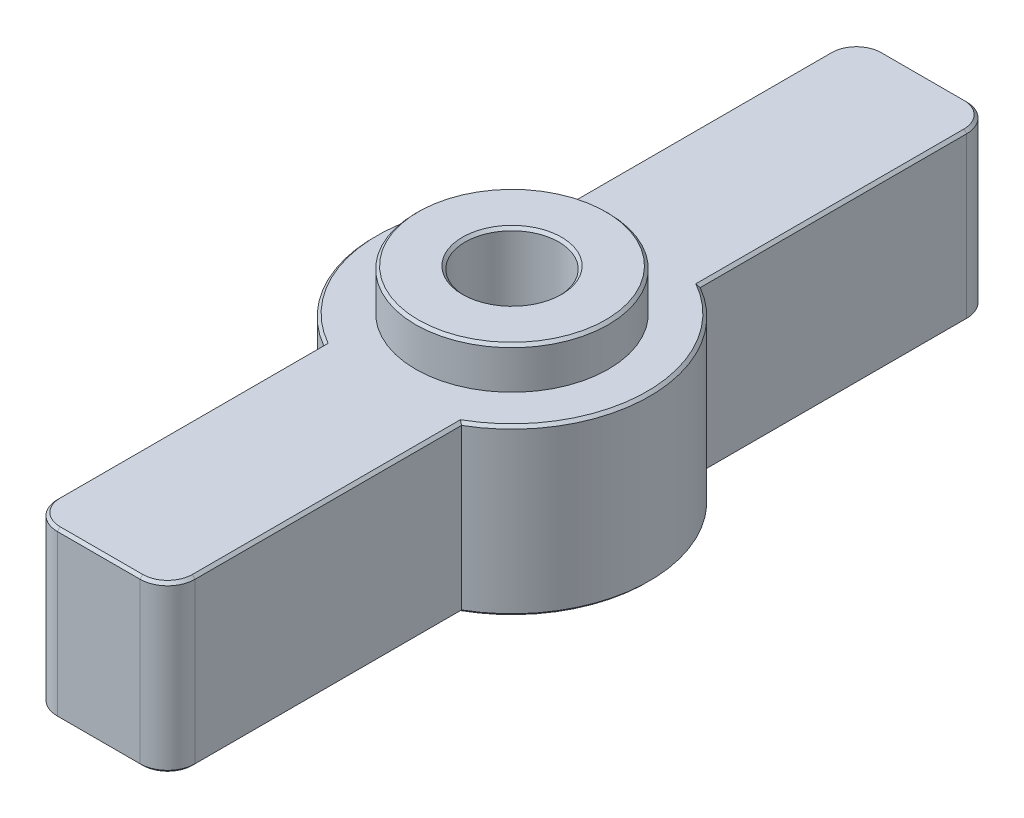
from build123d import *

# Parameters (mm, degrees)
EXTRUDE_1_DEPTH     = 12
SKETCH_2_R          = 6.75
CUT_EXTRUDE_1_DEPTH = 8.5
SKETCH_4_R          = 7
EXTRUDE_2_DEPTH     = 3
SKETCH_3_R          = 3.4
CUT_EXTRUDE_2_DEPTH = 33.74522866
CHAMFER_1_SIZE      = 0.2


with BuildPart() as part:
    # 草图1 → 凸台-拉伸1 (new body)
    with BuildSketch(Plane(origin=(0, 0, 0), x_dir=(1, 0, 0), z_dir=(0, 1, 0))):
        with BuildLine():
            Line((-5, -28), (-5, -8.660254038))
            ThreePointArc((-5, -8.660254038), (-10, 0), (-5, 8.660254038))
            Line((-5, 8.660254038), (-5, 28))
            ThreePointArc((-5, 28), (-4.414213562, 29.414213562), (-3, 30))
            Line((-3, 30), (3, 30))
            ThreePointArc((3, 30), (4.414213562, 29.414213562), (5, 28))
            Line((5, 28), (5, 8.660254038))
            ThreePointArc((5, 8.660254038), (10, 0), (5, -8.660254038))
            Line((5, -8.660254038), (5, -28))
            ThreePointArc((5, -28), (4.414213562, -29.414213562), (3, -30))
            Line((3, -30), (-3, -30))
            ThreePointArc((-3, -30), (-4.414213562, -29.414213562), (-5, -28))
        make_face()
    extrude(amount=EXTRUDE_1_DEPTH)

    # 草图2 → 切除-拉伸1 (cut)
    with BuildSketch(Plane.XZ):
        with Locations(Location((0, 0, 0), (0, 0, 270))):
            Circle(SKETCH_2_R)
    extrude(amount=-CUT_EXTRUDE_1_DEPTH, mode=Mode.SUBTRACT)

    # 草图4 → 凸台-拉伸2 (add)
    with BuildSketch(Plane(origin=(0, 12, 0), x_dir=(1, 0, 0), z_dir=(0, 1, 0))):
        with Locations(Location((0, 0, 0), (0, 0, 270))):
            Circle(SKETCH_4_R)
    extrude(amount=EXTRUDE_2_DEPTH)

    # 草图3 → 切除-拉伸2 (cut, through all)
    with BuildSketch(Plane.XZ.offset(-8.5)):
        with Locations(Location((0, 0, 0), (0, 0, 270))):
            Circle(SKETCH_3_R)
    extrude(amount=-CUT_EXTRUDE_2_DEPTH, mode=Mode.SUBTRACT)

    # 倒角1
    chamfer_1_edges = [part.edges().sort_by_distance(p)[0] for p in [
        (5, 0, 18.330127019),
        (4.414213562, 0, 29.414213562),
        (4.414213562, 12, -29.414213562),
        (0, 0, 30),
        (-4.414213562, 0, 29.414213562),
        (-5, 0, 18.330127019),
        (-10, 0, 0),
        (-5, 0, -18.330127019),
        (-4.414213562, 0, -29.414213562),
        (0, 0, -30),
        (4.414213562, 0, -29.414213562),
        (5, 0, -18.330127019),
        (10, 0, 0),
        (0, 12, -30),
        (-4.414213562, 12, -29.414213562),
        (-5, 12, -18.330127019),
        (-10, 12, 0),
        (-5, 12, 18.330127019),
        (-4.414213562, 12, 29.414213562),
        (0, 0, 6.75),
        (0, 12, 30),
        (0, 15, -7),
        (4.414213562, 12, 29.414213562),
        (0, 15, 3.4),
        (5, 12, 18.330127019),
        (10, 12, 0),
        (5, 12, -18.330127019),
    ]]
    chamfer(chamfer_1_edges, length=CHAMFER_1_SIZE)


solid = part.part
